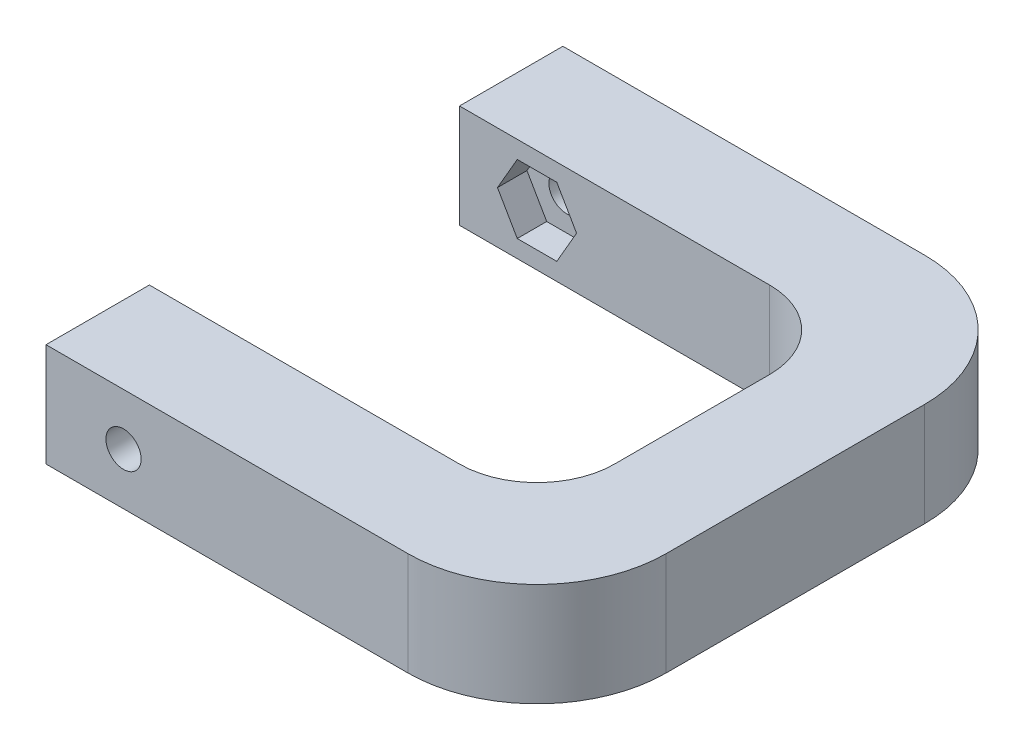
from build123d import *

# Parameters (mm, degrees)
BOSS_EXTRUDE1_DEPTH     = 20
CUT_EXTRUDE1_DEPTH      = 126.797456254
CUT_EXTRUDE1_DEPTH_BACK = 126.797456254
SKETCH3_R               = 3.4
CUT_EXTRUDE2_DEPTH      = 5.7
CUT_EXTRUDE3_START      = 60
CUT_EXTRUDE3_DEPTH      = 5.7
FILLET1_R               = 15
FILLET2_R               = 25


with BuildPart() as part:
    # Sketch2 → Boss-Extrude1 (new body)
    with BuildSketch(Plane(origin=(0, 0, 0), x_dir=(1, 0, 0), z_dir=(0, 1, 0))):
        Polygon((-95, 20), (-95, 0), (0, 0), (0, 100), (-95, 100), (-95, 80), (-20, 80), (-20, 20), align=None)
    extrude(amount=BOSS_EXTRUDE1_DEPTH)

    # Sketch3 → Cut-Extrude1 (cut, two sides: drawn at the far end of the back side and taken through both)
    with BuildSketch(Plane.XY.offset(-80).offset(-CUT_EXTRUDE1_DEPTH_BACK)):
        with Locations((-80, 10)):
            Circle(SKETCH3_R)
    extrude(amount=CUT_EXTRUDE1_DEPTH + CUT_EXTRUDE1_DEPTH_BACK, mode=Mode.SUBTRACT)

    # Sketch4 → Cut-Extrude2 (cut)
    with BuildSketch(Plane.XY.offset(-80)):
        Polygon((-76.175, 3.374905661), (-72.35, 10), (-76.175, 16.625094339), (-83.825, 16.625094339), (-87.65, 10), (-83.825, 3.374905661), align=None)
    extrude(amount=-CUT_EXTRUDE2_DEPTH, mode=Mode.SUBTRACT)

    # Sketch4<2> → Cut-Extrude3 (cut)
    with BuildSketch(Plane.XY.offset(-80).offset(CUT_EXTRUDE3_START)):
        Polygon((-76.175, 3.374905661), (-72.35, 10), (-76.175, 16.625094339), (-83.825, 16.625094339), (-87.65, 10), (-83.825, 3.374905661), align=None)
    extrude(amount=CUT_EXTRUDE3_DEPTH, mode=Mode.SUBTRACT)

    # Fillet1
    fillet1_edges = [part.edges().sort_by_distance(p)[0] for p in [
        (-20, 10, -20),
        (-20, 10, -80),
    ]]
    fillet(fillet1_edges, radius=FILLET1_R)

    # Fillet2
    fillet2_edges = [part.edges().sort_by_distance(p)[0] for p in [
        (0, 10, -100),
        (0, 10, 0),
    ]]
    fillet(fillet2_edges, radius=FILLET2_R)


solid = part.part
